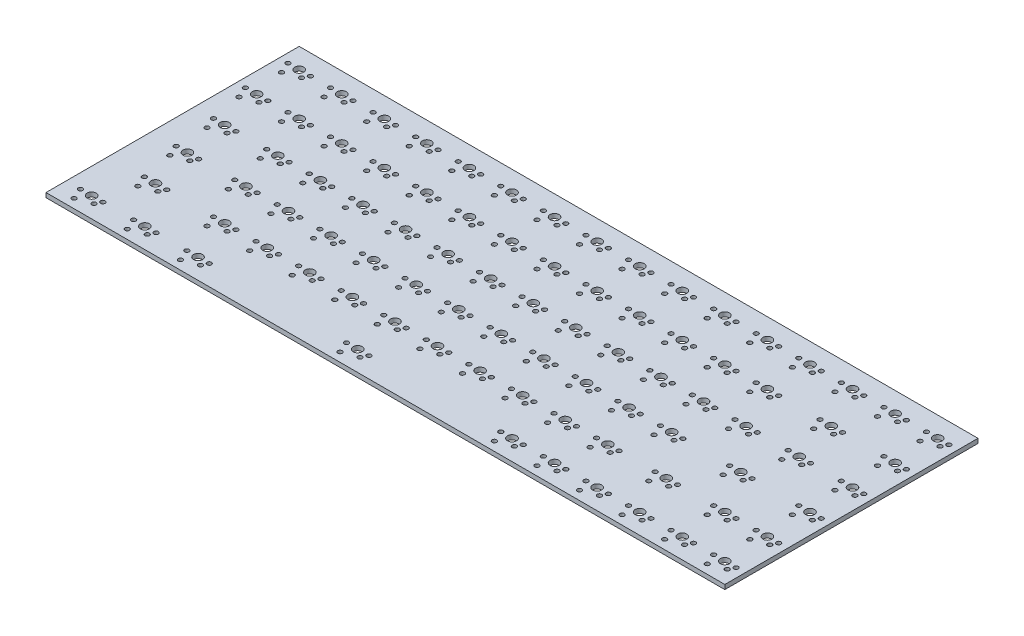
from build123d import *

# Parameters (mm, degrees)
SKETCH_1_W      = 303
SKETCH_1_H      = 113
SKETCH_1_R      = 1
SKETCH_1_R_2    = 2
EXTRUDE_1_DEPTH = 2


with BuildPart() as part:
    # Эскиз1 → Бобышка-Вытянуть1 (new body)
    with BuildSketch(Plane(origin=(0, 0, 0), x_dir=(1, 0, 0), z_dir=(0, 1, 0))):
        with Locations((142.5, -47.5)):
            Rectangle(SKETCH_1_W, SKETCH_1_H)
        with Locations(Location((3.65, -2.6, 0), (0, 0, 90))):
            Circle(SKETCH_1_R, mode=Mode.SUBTRACT)
        with Locations(Location((5, 0, 0), (0, 0, 270))):
            Circle(SKETCH_1_R, mode=Mode.SUBTRACT)
        with Locations(Location((-2.867586508, -5, 0), (0, 0, 90))):
            Circle(SKETCH_1_R, mode=Mode.SUBTRACT)
        with Locations(Location((-5, 0, 0), (0, 0, 270))):
            Circle(SKETCH_1_R, mode=Mode.SUBTRACT)
        with Locations(Location((0, 0, 0), (0, 0, 270))):
            Circle(SKETCH_1_R_2, mode=Mode.SUBTRACT)
        with Locations(Location((22.65, -2.6, 0), (0, 0, 90))):
            Circle(SKETCH_1_R, mode=Mode.SUBTRACT)
        with Locations(Location((24, 0, 0), (0, 0, 270))):
            Circle(SKETCH_1_R, mode=Mode.SUBTRACT)
        with Locations(Location((16.132413492, -5, 0), (0, 0, 90))):
            Circle(SKETCH_1_R, mode=Mode.SUBTRACT)
        with Locations(Location((14, 0, 0), (0, 0, 270))):
            Circle(SKETCH_1_R, mode=Mode.SUBTRACT)
        with Locations(Location((19, 0, 0), (0, 0, 270))):
            Circle(SKETCH_1_R_2, mode=Mode.SUBTRACT)
        with Locations(Location((41.65, -2.6, 0), (0, 0, 90))):
            Circle(SKETCH_1_R, mode=Mode.SUBTRACT)
        with Locations(Location((43, 0, 0), (0, 0, 270))):
            Circle(SKETCH_1_R, mode=Mode.SUBTRACT)
        with Locations(Location((35.132413492, -5, 0), (0, 0, 90))):
            Circle(SKETCH_1_R, mode=Mode.SUBTRACT)
        with Locations(Location((33, 0, 0), (0, 0, 270))):
            Circle(SKETCH_1_R, mode=Mode.SUBTRACT)
        with Locations(Location((38, 0, 0), (0, 0, 270))):
            Circle(SKETCH_1_R_2, mode=Mode.SUBTRACT)
        with Locations(Location((60.65, -2.6, 0), (0, 0, 90))):
            Circle(SKETCH_1_R, mode=Mode.SUBTRACT)
        with Locations(Location((62, 0, 0), (0, 0, 270))):
            Circle(SKETCH_1_R, mode=Mode.SUBTRACT)
        with Locations(Location((54.132413492, -5, 0), (0, 0, 90))):
            Circle(SKETCH_1_R, mode=Mode.SUBTRACT)
        with Locations(Location((52, 0, 0), (0, 0, 270))):
            Circle(SKETCH_1_R, mode=Mode.SUBTRACT)
        with Locations(Location((57, 0, 0), (0, 0, 270))):
            Circle(SKETCH_1_R_2, mode=Mode.SUBTRACT)
        with Locations(Location((79.65, -2.6, 0), (0, 0, 90))):
            Circle(SKETCH_1_R, mode=Mode.SUBTRACT)
        with Locations(Location((81, 0, 0), (0, 0, 270))):
            Circle(SKETCH_1_R, mode=Mode.SUBTRACT)
        with Locations(Location((73.132413492, -5, 0), (0, 0, 90))):
            Circle(SKETCH_1_R, mode=Mode.SUBTRACT)
        with Locations(Location((71, 0, 0), (0, 0, 270))):
            Circle(SKETCH_1_R, mode=Mode.SUBTRACT)
        with Locations(Location((76, 0, 0), (0, 0, 270))):
            Circle(SKETCH_1_R_2, mode=Mode.SUBTRACT)
        with Locations(Location((98.65, -2.6, 0), (0, 0, 90))):
            Circle(SKETCH_1_R, mode=Mode.SUBTRACT)
        with Locations(Location((100, 0, 0), (0, 0, 270))):
            Circle(SKETCH_1_R, mode=Mode.SUBTRACT)
        with Locations(Location((92.132413492, -5, 0), (0, 0, 90))):
            Circle(SKETCH_1_R, mode=Mode.SUBTRACT)
        with Locations(Location((90, 0, 0), (0, 0, 270))):
            Circle(SKETCH_1_R, mode=Mode.SUBTRACT)
        with Locations(Location((95, 0, 0), (0, 0, 270))):
            Circle(SKETCH_1_R_2, mode=Mode.SUBTRACT)
        with Locations(Location((117.65, -2.6, 0), (0, 0, 90))):
            Circle(SKETCH_1_R, mode=Mode.SUBTRACT)
        with Locations(Location((119, 0, 0), (0, 0, 270))):
            Circle(SKETCH_1_R, mode=Mode.SUBTRACT)
        with Locations(Location((111.132413492, -5, 0), (0, 0, 90))):
            Circle(SKETCH_1_R, mode=Mode.SUBTRACT)
        with Locations(Location((109, 0, 0), (0, 0, 270))):
            Circle(SKETCH_1_R, mode=Mode.SUBTRACT)
        with Locations(Location((114, 0, 0), (0, 0, 270))):
            Circle(SKETCH_1_R_2, mode=Mode.SUBTRACT)
        with Locations(Location((136.65, -2.6, 0), (0, 0, 90))):
            Circle(SKETCH_1_R, mode=Mode.SUBTRACT)
        with Locations(Location((138, 0, 0), (0, 0, 270))):
            Circle(SKETCH_1_R, mode=Mode.SUBTRACT)
        with Locations(Location((130.132413492, -5, 0), (0, 0, 90))):
            Circle(SKETCH_1_R, mode=Mode.SUBTRACT)
        with Locations(Location((128, 0, 0), (0, 0, 270))):
            Circle(SKETCH_1_R, mode=Mode.SUBTRACT)
        with Locations(Location((133, 0, 0), (0, 0, 270))):
            Circle(SKETCH_1_R_2, mode=Mode.SUBTRACT)
        with Locations(Location((155.65, -2.6, 0), (0, 0, 90))):
            Circle(SKETCH_1_R, mode=Mode.SUBTRACT)
        with Locations(Location((157, 0, 0), (0, 0, 270))):
            Circle(SKETCH_1_R, mode=Mode.SUBTRACT)
        with Locations(Location((149.132413492, -5, 0), (0, 0, 90))):
            Circle(SKETCH_1_R, mode=Mode.SUBTRACT)
        with Locations(Location((147, 0, 0), (0, 0, 270))):
            Circle(SKETCH_1_R, mode=Mode.SUBTRACT)
        with Locations(Location((152, 0, 0), (0, 0, 270))):
            Circle(SKETCH_1_R_2, mode=Mode.SUBTRACT)
        with Locations(Location((174.65, -2.6, 0), (0, 0, 90))):
            Circle(SKETCH_1_R, mode=Mode.SUBTRACT)
        with Locations(Location((176, 0, 0), (0, 0, 270))):
            Circle(SKETCH_1_R, mode=Mode.SUBTRACT)
        with Locations(Location((168.132413492, -5, 0), (0, 0, 90))):
            Circle(SKETCH_1_R, mode=Mode.SUBTRACT)
        with Locations(Location((166, 0, 0), (0, 0, 270))):
            Circle(SKETCH_1_R, mode=Mode.SUBTRACT)
        with Locations(Location((171, 0, 0), (0, 0, 270))):
            Circle(SKETCH_1_R_2, mode=Mode.SUBTRACT)
        with Locations(Location((193.65, -2.6, 0), (0, 0, 90))):
            Circle(SKETCH_1_R, mode=Mode.SUBTRACT)
        with Locations(Location((195, 0, 0), (0, 0, 270))):
            Circle(SKETCH_1_R, mode=Mode.SUBTRACT)
        with Locations(Location((187.132413492, -5, 0), (0, 0, 90))):
            Circle(SKETCH_1_R, mode=Mode.SUBTRACT)
        with Locations(Location((185, 0, 0), (0, 0, 270))):
            Circle(SKETCH_1_R, mode=Mode.SUBTRACT)
        with Locations(Location((190, 0, 0), (0, 0, 270))):
            Circle(SKETCH_1_R_2, mode=Mode.SUBTRACT)
        with Locations(Location((212.65, -2.6, 0), (0, 0, 90))):
            Circle(SKETCH_1_R, mode=Mode.SUBTRACT)
        with Locations(Location((214, 0, 0), (0, 0, 270))):
            Circle(SKETCH_1_R, mode=Mode.SUBTRACT)
        with Locations(Location((206.132413492, -5, 0), (0, 0, 90))):
            Circle(SKETCH_1_R, mode=Mode.SUBTRACT)
        with Locations(Location((204, 0, 0), (0, 0, 270))):
            Circle(SKETCH_1_R, mode=Mode.SUBTRACT)
        with Locations(Location((209, 0, 0), (0, 0, 270))):
            Circle(SKETCH_1_R_2, mode=Mode.SUBTRACT)
        with Locations(Location((212.65, -21.6, 0), (0, 0, 90))):
            Circle(SKETCH_1_R, mode=Mode.SUBTRACT)
        with Locations(Location((214, -19, 0), (0, 0, 270))):
            Circle(SKETCH_1_R, mode=Mode.SUBTRACT)
        with Locations(Location((206.132413492, -24, 0), (0, 0, 90))):
            Circle(SKETCH_1_R, mode=Mode.SUBTRACT)
        with Locations(Location((204, -19, 0), (0, 0, 270))):
            Circle(SKETCH_1_R, mode=Mode.SUBTRACT)
        with Locations(Location((209, -19, 0), (0, 0, 270))):
            Circle(SKETCH_1_R_2, mode=Mode.SUBTRACT)
        with Locations(Location((193.65, -21.6, 0), (0, 0, 90))):
            Circle(SKETCH_1_R, mode=Mode.SUBTRACT)
        with Locations(Location((195, -19, 0), (0, 0, 270))):
            Circle(SKETCH_1_R, mode=Mode.SUBTRACT)
        with Locations(Location((187.132413492, -24, 0), (0, 0, 90))):
            Circle(SKETCH_1_R, mode=Mode.SUBTRACT)
        with Locations(Location((185, -19, 0), (0, 0, 270))):
            Circle(SKETCH_1_R, mode=Mode.SUBTRACT)
        with Locations(Location((190, -19, 0), (0, 0, 270))):
            Circle(SKETCH_1_R_2, mode=Mode.SUBTRACT)
        with Locations(Location((174.65, -21.6, 0), (0, 0, 90))):
            Circle(SKETCH_1_R, mode=Mode.SUBTRACT)
        with Locations(Location((176, -19, 0), (0, 0, 270))):
            Circle(SKETCH_1_R, mode=Mode.SUBTRACT)
        with Locations(Location((168.132413492, -24, 0), (0, 0, 90))):
            Circle(SKETCH_1_R, mode=Mode.SUBTRACT)
        with Locations(Location((166, -19, 0), (0, 0, 270))):
            Circle(SKETCH_1_R, mode=Mode.SUBTRACT)
        with Locations(Location((171, -19, 0), (0, 0, 270))):
            Circle(SKETCH_1_R_2, mode=Mode.SUBTRACT)
        with Locations(Location((155.65, -21.6, 0), (0, 0, 90))):
            Circle(SKETCH_1_R, mode=Mode.SUBTRACT)
        with Locations(Location((157, -19, 0), (0, 0, 270))):
            Circle(SKETCH_1_R, mode=Mode.SUBTRACT)
        with Locations(Location((149.132413492, -24, 0), (0, 0, 90))):
            Circle(SKETCH_1_R, mode=Mode.SUBTRACT)
        with Locations(Location((147, -19, 0), (0, 0, 270))):
            Circle(SKETCH_1_R, mode=Mode.SUBTRACT)
        with Locations(Location((152, -19, 0), (0, 0, 270))):
            Circle(SKETCH_1_R_2, mode=Mode.SUBTRACT)
        with Locations(Location((136.65, -21.6, 0), (0, 0, 90))):
            Circle(SKETCH_1_R, mode=Mode.SUBTRACT)
        with Locations(Location((138, -19, 0), (0, 0, 270))):
            Circle(SKETCH_1_R, mode=Mode.SUBTRACT)
        with Locations(Location((130.132413492, -24, 0), (0, 0, 90))):
            Circle(SKETCH_1_R, mode=Mode.SUBTRACT)
        with Locations(Location((128, -19, 0), (0, 0, 270))):
            Circle(SKETCH_1_R, mode=Mode.SUBTRACT)
        with Locations(Location((133, -19, 0), (0, 0, 270))):
            Circle(SKETCH_1_R_2, mode=Mode.SUBTRACT)
        with Locations(Location((117.65, -21.6, 0), (0, 0, 90))):
            Circle(SKETCH_1_R, mode=Mode.SUBTRACT)
        with Locations(Location((119, -19, 0), (0, 0, 270))):
            Circle(SKETCH_1_R, mode=Mode.SUBTRACT)
        with Locations(Location((111.132413492, -24, 0), (0, 0, 90))):
            Circle(SKETCH_1_R, mode=Mode.SUBTRACT)
        with Locations(Location((109, -19, 0), (0, 0, 270))):
            Circle(SKETCH_1_R, mode=Mode.SUBTRACT)
        with Locations(Location((114, -19, 0), (0, 0, 270))):
            Circle(SKETCH_1_R_2, mode=Mode.SUBTRACT)
        with Locations(Location((98.65, -21.6, 0), (0, 0, 90))):
            Circle(SKETCH_1_R, mode=Mode.SUBTRACT)
        with Locations(Location((100, -19, 0), (0, 0, 270))):
            Circle(SKETCH_1_R, mode=Mode.SUBTRACT)
        with Locations(Location((92.132413492, -24, 0), (0, 0, 90))):
            Circle(SKETCH_1_R, mode=Mode.SUBTRACT)
        with Locations(Location((90, -19, 0), (0, 0, 270))):
            Circle(SKETCH_1_R, mode=Mode.SUBTRACT)
        with Locations(Location((95, -19, 0), (0, 0, 270))):
            Circle(SKETCH_1_R_2, mode=Mode.SUBTRACT)
        with Locations(Location((79.65, -21.6, 0), (0, 0, 90))):
            Circle(SKETCH_1_R, mode=Mode.SUBTRACT)
        with Locations(Location((81, -19, 0), (0, 0, 270))):
            Circle(SKETCH_1_R, mode=Mode.SUBTRACT)
        with Locations(Location((73.132413492, -24, 0), (0, 0, 90))):
            Circle(SKETCH_1_R, mode=Mode.SUBTRACT)
        with Locations(Location((71, -19, 0), (0, 0, 270))):
            Circle(SKETCH_1_R, mode=Mode.SUBTRACT)
        with Locations(Location((76, -19, 0), (0, 0, 270))):
            Circle(SKETCH_1_R_2, mode=Mode.SUBTRACT)
        with Locations(Location((60.65, -21.6, 0), (0, 0, 90))):
            Circle(SKETCH_1_R, mode=Mode.SUBTRACT)
        with Locations(Location((62, -19, 0), (0, 0, 270))):
            Circle(SKETCH_1_R, mode=Mode.SUBTRACT)
        with Locations(Location((54.132413492, -24, 0), (0, 0, 90))):
            Circle(SKETCH_1_R, mode=Mode.SUBTRACT)
        with Locations(Location((52, -19, 0), (0, 0, 270))):
            Circle(SKETCH_1_R, mode=Mode.SUBTRACT)
        with Locations(Location((57, -19, 0), (0, 0, 270))):
            Circle(SKETCH_1_R_2, mode=Mode.SUBTRACT)
        with Locations(Location((41.65, -21.6, 0), (0, 0, 90))):
            Circle(SKETCH_1_R, mode=Mode.SUBTRACT)
        with Locations(Location((43, -19, 0), (0, 0, 270))):
            Circle(SKETCH_1_R, mode=Mode.SUBTRACT)
        with Locations(Location((35.132413492, -24, 0), (0, 0, 90))):
            Circle(SKETCH_1_R, mode=Mode.SUBTRACT)
        with Locations(Location((33, -19, 0), (0, 0, 270))):
            Circle(SKETCH_1_R, mode=Mode.SUBTRACT)
        with Locations(Location((38, -19, 0), (0, 0, 270))):
            Circle(SKETCH_1_R_2, mode=Mode.SUBTRACT)
        with Locations(Location((22.65, -21.6, 0), (0, 0, 90))):
            Circle(SKETCH_1_R, mode=Mode.SUBTRACT)
        with Locations(Location((24, -19, 0), (0, 0, 270))):
            Circle(SKETCH_1_R, mode=Mode.SUBTRACT)
        with Locations(Location((16.132413492, -24, 0), (0, 0, 90))):
            Circle(SKETCH_1_R, mode=Mode.SUBTRACT)
        with Locations(Location((14, -19, 0), (0, 0, 270))):
            Circle(SKETCH_1_R, mode=Mode.SUBTRACT)
        with Locations(Location((19, -19, 0), (0, 0, 270))):
            Circle(SKETCH_1_R_2, mode=Mode.SUBTRACT)
        with Locations(Location((3.65, -21.6, 0), (0, 0, 90))):
            Circle(SKETCH_1_R, mode=Mode.SUBTRACT)
        with Locations(Location((5, -19, 0), (0, 0, 270))):
            Circle(SKETCH_1_R, mode=Mode.SUBTRACT)
        with Locations(Location((-2.867586508, -24, 0), (0, 0, 90))):
            Circle(SKETCH_1_R, mode=Mode.SUBTRACT)
        with Locations(Location((-5, -19, 0), (0, 0, 270))):
            Circle(SKETCH_1_R, mode=Mode.SUBTRACT)
        with Locations(Location((0, -19, 0), (0, 0, 270))):
            Circle(SKETCH_1_R_2, mode=Mode.SUBTRACT)
        with Locations(Location((8.4, -40.6, 0), (0, 0, 90))):
            Circle(SKETCH_1_R, mode=Mode.SUBTRACT)
        with Locations(Location((9.75, -38, 0), (0, 0, 270))):
            Circle(SKETCH_1_R, mode=Mode.SUBTRACT)
        with Locations(Location((1.882413492, -43, 0), (0, 0, 90))):
            Circle(SKETCH_1_R, mode=Mode.SUBTRACT)
        with Locations(Location((-0.25, -38, 0), (0, 0, 270))):
            Circle(SKETCH_1_R, mode=Mode.SUBTRACT)
        with Locations(Location((4.75, -38, 0), (0, 0, 270))):
            Circle(SKETCH_1_R_2, mode=Mode.SUBTRACT)
        with Locations(Location((32.15, -40.6, 0), (0, 0, 90))):
            Circle(SKETCH_1_R, mode=Mode.SUBTRACT)
        with Locations(Location((33.5, -38, 0), (0, 0, 270))):
            Circle(SKETCH_1_R, mode=Mode.SUBTRACT)
        with Locations(Location((25.632413492, -43, 0), (0, 0, 90))):
            Circle(SKETCH_1_R, mode=Mode.SUBTRACT)
        with Locations(Location((23.5, -38, 0), (0, 0, 270))):
            Circle(SKETCH_1_R, mode=Mode.SUBTRACT)
        with Locations(Location((28.5, -38, 0), (0, 0, 270))):
            Circle(SKETCH_1_R_2, mode=Mode.SUBTRACT)
        with Locations(Location((51.15, -40.6, 0), (0, 0, 90))):
            Circle(SKETCH_1_R, mode=Mode.SUBTRACT)
        with Locations(Location((52.5, -38, 0), (0, 0, 270))):
            Circle(SKETCH_1_R, mode=Mode.SUBTRACT)
        with Locations(Location((44.632413492, -43, 0), (0, 0, 90))):
            Circle(SKETCH_1_R, mode=Mode.SUBTRACT)
        with Locations(Location((42.5, -38, 0), (0, 0, 270))):
            Circle(SKETCH_1_R, mode=Mode.SUBTRACT)
        with Locations(Location((47.5, -38, 0), (0, 0, 270))):
            Circle(SKETCH_1_R_2, mode=Mode.SUBTRACT)
        with Locations(Location((70.15, -40.6, 0), (0, 0, 90))):
            Circle(SKETCH_1_R, mode=Mode.SUBTRACT)
        with Locations(Location((71.5, -38, 0), (0, 0, 270))):
            Circle(SKETCH_1_R, mode=Mode.SUBTRACT)
        with Locations(Location((63.632413492, -43, 0), (0, 0, 90))):
            Circle(SKETCH_1_R, mode=Mode.SUBTRACT)
        with Locations(Location((61.5, -38, 0), (0, 0, 270))):
            Circle(SKETCH_1_R, mode=Mode.SUBTRACT)
        with Locations(Location((66.5, -38, 0), (0, 0, 270))):
            Circle(SKETCH_1_R_2, mode=Mode.SUBTRACT)
        with Locations(Location((89.15, -40.6, 0), (0, 0, 90))):
            Circle(SKETCH_1_R, mode=Mode.SUBTRACT)
        with Locations(Location((90.5, -38, 0), (0, 0, 270))):
            Circle(SKETCH_1_R, mode=Mode.SUBTRACT)
        with Locations(Location((82.632413492, -43, 0), (0, 0, 90))):
            Circle(SKETCH_1_R, mode=Mode.SUBTRACT)
        with Locations(Location((80.5, -38, 0), (0, 0, 270))):
            Circle(SKETCH_1_R, mode=Mode.SUBTRACT)
        with Locations(Location((85.5, -38, 0), (0, 0, 270))):
            Circle(SKETCH_1_R_2, mode=Mode.SUBTRACT)
        with Locations(Location((104.5, -38, 0), (0, 0, 270))):
            Circle(SKETCH_1_R_2, mode=Mode.SUBTRACT)
        with Locations(Location((109.5, -38, 0), (0, 0, 270))):
            Circle(SKETCH_1_R, mode=Mode.SUBTRACT)
        with Locations(Location((99.5, -38, 0), (0, 0, 270))):
            Circle(SKETCH_1_R, mode=Mode.SUBTRACT)
        with Locations(Location((101.632413492, -43, 0), (0, 0, 90))):
            Circle(SKETCH_1_R, mode=Mode.SUBTRACT)
        with Locations(Location((108.15, -40.6, 0), (0, 0, 90))):
            Circle(SKETCH_1_R, mode=Mode.SUBTRACT)
        with Locations(Location((123.5, -38, 0), (0, 0, 270))):
            Circle(SKETCH_1_R_2, mode=Mode.SUBTRACT)
        with Locations(Location((128.5, -38, 0), (0, 0, 270))):
            Circle(SKETCH_1_R, mode=Mode.SUBTRACT)
        with Locations(Location((118.5, -38, 0), (0, 0, 270))):
            Circle(SKETCH_1_R, mode=Mode.SUBTRACT)
        with Locations(Location((120.632413492, -43, 0), (0, 0, 90))):
            Circle(SKETCH_1_R, mode=Mode.SUBTRACT)
        with Locations(Location((127.15, -40.6, 0), (0, 0, 90))):
            Circle(SKETCH_1_R, mode=Mode.SUBTRACT)
        with Locations(Location((142.5, -38, 0), (0, 0, 270))):
            Circle(SKETCH_1_R_2, mode=Mode.SUBTRACT)
        with Locations(Location((147.5, -38, 0), (0, 0, 270))):
            Circle(SKETCH_1_R, mode=Mode.SUBTRACT)
        with Locations(Location((137.5, -38, 0), (0, 0, 270))):
            Circle(SKETCH_1_R, mode=Mode.SUBTRACT)
        with Locations(Location((139.632413492, -43, 0), (0, 0, 90))):
            Circle(SKETCH_1_R, mode=Mode.SUBTRACT)
        with Locations(Location((146.15, -40.6, 0), (0, 0, 90))):
            Circle(SKETCH_1_R, mode=Mode.SUBTRACT)
        with Locations(Location((161.5, -38, 0), (0, 0, 270))):
            Circle(SKETCH_1_R_2, mode=Mode.SUBTRACT)
        with Locations(Location((166.5, -38, 0), (0, 0, 270))):
            Circle(SKETCH_1_R, mode=Mode.SUBTRACT)
        with Locations(Location((156.5, -38, 0), (0, 0, 270))):
            Circle(SKETCH_1_R, mode=Mode.SUBTRACT)
        with Locations(Location((158.632413492, -43, 0), (0, 0, 90))):
            Circle(SKETCH_1_R, mode=Mode.SUBTRACT)
        with Locations(Location((165.15, -40.6, 0), (0, 0, 90))):
            Circle(SKETCH_1_R, mode=Mode.SUBTRACT)
        with Locations(Location((180.5, -38, 0), (0, 0, 270))):
            Circle(SKETCH_1_R_2, mode=Mode.SUBTRACT)
        with Locations(Location((185.5, -38, 0), (0, 0, 270))):
            Circle(SKETCH_1_R, mode=Mode.SUBTRACT)
        with Locations(Location((175.5, -38, 0), (0, 0, 270))):
            Circle(SKETCH_1_R, mode=Mode.SUBTRACT)
        with Locations(Location((177.632413492, -43, 0), (0, 0, 90))):
            Circle(SKETCH_1_R, mode=Mode.SUBTRACT)
        with Locations(Location((184.15, -40.6, 0), (0, 0, 90))):
            Circle(SKETCH_1_R, mode=Mode.SUBTRACT)
        with Locations(Location((199.5, -38, 0), (0, 0, 270))):
            Circle(SKETCH_1_R_2, mode=Mode.SUBTRACT)
        with Locations(Location((204.5, -38, 0), (0, 0, 270))):
            Circle(SKETCH_1_R, mode=Mode.SUBTRACT)
        with Locations(Location((194.5, -38, 0), (0, 0, 270))):
            Circle(SKETCH_1_R, mode=Mode.SUBTRACT)
        with Locations(Location((196.632413492, -43, 0), (0, 0, 90))):
            Circle(SKETCH_1_R, mode=Mode.SUBTRACT)
        with Locations(Location((203.15, -40.6, 0), (0, 0, 90))):
            Circle(SKETCH_1_R, mode=Mode.SUBTRACT)
        with Locations(Location((204.25, -57, 0), (0, 0, 270))):
            Circle(SKETCH_1_R_2, mode=Mode.SUBTRACT)
        with Locations(Location((209.25, -57, 0), (0, 0, 270))):
            Circle(SKETCH_1_R, mode=Mode.SUBTRACT)
        with Locations(Location((199.25, -57, 0), (0, 0, 270))):
            Circle(SKETCH_1_R, mode=Mode.SUBTRACT)
        with Locations(Location((201.382413492, -62, 0), (0, 0, 90))):
            Circle(SKETCH_1_R, mode=Mode.SUBTRACT)
        with Locations(Location((207.9, -59.6, 0), (0, 0, 90))):
            Circle(SKETCH_1_R, mode=Mode.SUBTRACT)
        with Locations(Location((185.25, -57, 0), (0, 0, 270))):
            Circle(SKETCH_1_R_2, mode=Mode.SUBTRACT)
        with Locations(Location((190.25, -57, 0), (0, 0, 270))):
            Circle(SKETCH_1_R, mode=Mode.SUBTRACT)
        with Locations(Location((180.25, -57, 0), (0, 0, 270))):
            Circle(SKETCH_1_R, mode=Mode.SUBTRACT)
        with Locations(Location((182.382413492, -62, 0), (0, 0, 90))):
            Circle(SKETCH_1_R, mode=Mode.SUBTRACT)
        with Locations(Location((188.9, -59.6, 0), (0, 0, 90))):
            Circle(SKETCH_1_R, mode=Mode.SUBTRACT)
        with Locations(Location((166.25, -57, 0), (0, 0, 270))):
            Circle(SKETCH_1_R_2, mode=Mode.SUBTRACT)
        with Locations(Location((171.25, -57, 0), (0, 0, 270))):
            Circle(SKETCH_1_R, mode=Mode.SUBTRACT)
        with Locations(Location((161.25, -57, 0), (0, 0, 270))):
            Circle(SKETCH_1_R, mode=Mode.SUBTRACT)
        with Locations(Location((163.382413492, -62, 0), (0, 0, 90))):
            Circle(SKETCH_1_R, mode=Mode.SUBTRACT)
        with Locations(Location((169.9, -59.6, 0), (0, 0, 90))):
            Circle(SKETCH_1_R, mode=Mode.SUBTRACT)
        with Locations(Location((147.25, -57, 0), (0, 0, 270))):
            Circle(SKETCH_1_R_2, mode=Mode.SUBTRACT)
        with Locations(Location((152.25, -57, 0), (0, 0, 270))):
            Circle(SKETCH_1_R, mode=Mode.SUBTRACT)
        with Locations(Location((142.25, -57, 0), (0, 0, 270))):
            Circle(SKETCH_1_R, mode=Mode.SUBTRACT)
        with Locations(Location((144.382413492, -62, 0), (0, 0, 90))):
            Circle(SKETCH_1_R, mode=Mode.SUBTRACT)
        with Locations(Location((150.9, -59.6, 0), (0, 0, 90))):
            Circle(SKETCH_1_R, mode=Mode.SUBTRACT)
        with Locations(Location((128.25, -57, 0), (0, 0, 270))):
            Circle(SKETCH_1_R_2, mode=Mode.SUBTRACT)
        with Locations(Location((133.25, -57, 0), (0, 0, 270))):
            Circle(SKETCH_1_R, mode=Mode.SUBTRACT)
        with Locations(Location((123.25, -57, 0), (0, 0, 270))):
            Circle(SKETCH_1_R, mode=Mode.SUBTRACT)
        with Locations(Location((125.382413492, -62, 0), (0, 0, 90))):
            Circle(SKETCH_1_R, mode=Mode.SUBTRACT)
        with Locations(Location((131.9, -59.6, 0), (0, 0, 90))):
            Circle(SKETCH_1_R, mode=Mode.SUBTRACT)
        with Locations(Location((109.25, -57, 0), (0, 0, 270))):
            Circle(SKETCH_1_R_2, mode=Mode.SUBTRACT)
        with Locations(Location((114.25, -57, 0), (0, 0, 270))):
            Circle(SKETCH_1_R, mode=Mode.SUBTRACT)
        with Locations(Location((104.25, -57, 0), (0, 0, 270))):
            Circle(SKETCH_1_R, mode=Mode.SUBTRACT)
        with Locations(Location((106.382413492, -62, 0), (0, 0, 90))):
            Circle(SKETCH_1_R, mode=Mode.SUBTRACT)
        with Locations(Location((112.9, -59.6, 0), (0, 0, 90))):
            Circle(SKETCH_1_R, mode=Mode.SUBTRACT)
        with Locations(Location((90.25, -57, 0), (0, 0, 270))):
            Circle(SKETCH_1_R_2, mode=Mode.SUBTRACT)
        with Locations(Location((95.25, -57, 0), (0, 0, 270))):
            Circle(SKETCH_1_R, mode=Mode.SUBTRACT)
        with Locations(Location((85.25, -57, 0), (0, 0, 270))):
            Circle(SKETCH_1_R, mode=Mode.SUBTRACT)
        with Locations(Location((87.382413492, -62, 0), (0, 0, 90))):
            Circle(SKETCH_1_R, mode=Mode.SUBTRACT)
        with Locations(Location((93.9, -59.6, 0), (0, 0, 90))):
            Circle(SKETCH_1_R, mode=Mode.SUBTRACT)
        with Locations(Location((71.25, -57, 0), (0, 0, 270))):
            Circle(SKETCH_1_R_2, mode=Mode.SUBTRACT)
        with Locations(Location((76.25, -57, 0), (0, 0, 270))):
            Circle(SKETCH_1_R, mode=Mode.SUBTRACT)
        with Locations(Location((66.25, -57, 0), (0, 0, 270))):
            Circle(SKETCH_1_R, mode=Mode.SUBTRACT)
        with Locations(Location((68.382413492, -62, 0), (0, 0, 90))):
            Circle(SKETCH_1_R, mode=Mode.SUBTRACT)
        with Locations(Location((74.9, -59.6, 0), (0, 0, 90))):
            Circle(SKETCH_1_R, mode=Mode.SUBTRACT)
        with Locations(Location((52.25, -57, 0), (0, 0, 270))):
            Circle(SKETCH_1_R_2, mode=Mode.SUBTRACT)
        with Locations(Location((57.25, -57, 0), (0, 0, 270))):
            Circle(SKETCH_1_R, mode=Mode.SUBTRACT)
        with Locations(Location((47.25, -57, 0), (0, 0, 270))):
            Circle(SKETCH_1_R, mode=Mode.SUBTRACT)
        with Locations(Location((49.382413492, -62, 0), (0, 0, 90))):
            Circle(SKETCH_1_R, mode=Mode.SUBTRACT)
        with Locations(Location((55.9, -59.6, 0), (0, 0, 90))):
            Circle(SKETCH_1_R, mode=Mode.SUBTRACT)
        with Locations(Location((33.25, -57, 0), (0, 0, 270))):
            Circle(SKETCH_1_R_2, mode=Mode.SUBTRACT)
        with Locations(Location((38.25, -57, 0), (0, 0, 270))):
            Circle(SKETCH_1_R, mode=Mode.SUBTRACT)
        with Locations(Location((28.25, -57, 0), (0, 0, 270))):
            Circle(SKETCH_1_R, mode=Mode.SUBTRACT)
        with Locations(Location((30.382413492, -62, 0), (0, 0, 90))):
            Circle(SKETCH_1_R, mode=Mode.SUBTRACT)
        with Locations(Location((36.9, -59.6, 0), (0, 0, 90))):
            Circle(SKETCH_1_R, mode=Mode.SUBTRACT)
        with Locations(Location((7.125, -57, 0), (0, 0, 270))):
            Circle(SKETCH_1_R_2, mode=Mode.SUBTRACT)
        with Locations(Location((12.125, -57, 0), (0, 0, 270))):
            Circle(SKETCH_1_R, mode=Mode.SUBTRACT)
        with Locations(Location((2.125, -57, 0), (0, 0, 270))):
            Circle(SKETCH_1_R, mode=Mode.SUBTRACT)
        with Locations(Location((4.257413492, -62, 0), (0, 0, 90))):
            Circle(SKETCH_1_R, mode=Mode.SUBTRACT)
        with Locations(Location((10.775, -59.6, 0), (0, 0, 90))):
            Circle(SKETCH_1_R, mode=Mode.SUBTRACT)
        with Locations(Location((11.875, -76, 0), (0, 0, 270))):
            Circle(SKETCH_1_R_2, mode=Mode.SUBTRACT)
        with Locations(Location((16.875, -76, 0), (0, 0, 270))):
            Circle(SKETCH_1_R, mode=Mode.SUBTRACT)
        with Locations(Location((6.875, -76, 0), (0, 0, 270))):
            Circle(SKETCH_1_R, mode=Mode.SUBTRACT)
        with Locations(Location((9.007413492, -81, 0), (0, 0, 90))):
            Circle(SKETCH_1_R, mode=Mode.SUBTRACT)
        with Locations(Location((15.525, -78.6, 0), (0, 0, 90))):
            Circle(SKETCH_1_R, mode=Mode.SUBTRACT)
        with Locations(Location((42.75, -76, 0), (0, 0, 270))):
            Circle(SKETCH_1_R_2, mode=Mode.SUBTRACT)
        with Locations(Location((47.75, -76, 0), (0, 0, 270))):
            Circle(SKETCH_1_R, mode=Mode.SUBTRACT)
        with Locations(Location((37.75, -76, 0), (0, 0, 270))):
            Circle(SKETCH_1_R, mode=Mode.SUBTRACT)
        with Locations(Location((39.882413492, -81, 0), (0, 0, 90))):
            Circle(SKETCH_1_R, mode=Mode.SUBTRACT)
        with Locations(Location((46.4, -78.6, 0), (0, 0, 90))):
            Circle(SKETCH_1_R, mode=Mode.SUBTRACT)
        with Locations(Location((61.75, -76, 0), (0, 0, 270))):
            Circle(SKETCH_1_R_2, mode=Mode.SUBTRACT)
        with Locations(Location((66.75, -76, 0), (0, 0, 270))):
            Circle(SKETCH_1_R, mode=Mode.SUBTRACT)
        with Locations(Location((56.75, -76, 0), (0, 0, 270))):
            Circle(SKETCH_1_R, mode=Mode.SUBTRACT)
        with Locations(Location((58.882413492, -81, 0), (0, 0, 90))):
            Circle(SKETCH_1_R, mode=Mode.SUBTRACT)
        with Locations(Location((65.4, -78.6, 0), (0, 0, 90))):
            Circle(SKETCH_1_R, mode=Mode.SUBTRACT)
        with Locations(Location((80.75, -76, 0), (0, 0, 270))):
            Circle(SKETCH_1_R_2, mode=Mode.SUBTRACT)
        with Locations(Location((85.75, -76, 0), (0, 0, 270))):
            Circle(SKETCH_1_R, mode=Mode.SUBTRACT)
        with Locations(Location((75.75, -76, 0), (0, 0, 270))):
            Circle(SKETCH_1_R, mode=Mode.SUBTRACT)
        with Locations(Location((77.882413492, -81, 0), (0, 0, 90))):
            Circle(SKETCH_1_R, mode=Mode.SUBTRACT)
        with Locations(Location((84.4, -78.6, 0), (0, 0, 90))):
            Circle(SKETCH_1_R, mode=Mode.SUBTRACT)
        with Locations(Location((99.75, -76, 0), (0, 0, 270))):
            Circle(SKETCH_1_R_2, mode=Mode.SUBTRACT)
        with Locations(Location((104.75, -76, 0), (0, 0, 270))):
            Circle(SKETCH_1_R, mode=Mode.SUBTRACT)
        with Locations(Location((94.75, -76, 0), (0, 0, 270))):
            Circle(SKETCH_1_R, mode=Mode.SUBTRACT)
        with Locations(Location((96.882413492, -81, 0), (0, 0, 90))):
            Circle(SKETCH_1_R, mode=Mode.SUBTRACT)
        with Locations(Location((103.4, -78.6, 0), (0, 0, 90))):
            Circle(SKETCH_1_R, mode=Mode.SUBTRACT)
        with Locations(Location((118.75, -76, 0), (0, 0, 270))):
            Circle(SKETCH_1_R_2, mode=Mode.SUBTRACT)
        with Locations(Location((123.75, -76, 0), (0, 0, 270))):
            Circle(SKETCH_1_R, mode=Mode.SUBTRACT)
        with Locations(Location((113.75, -76, 0), (0, 0, 270))):
            Circle(SKETCH_1_R, mode=Mode.SUBTRACT)
        with Locations(Location((115.882413492, -81, 0), (0, 0, 90))):
            Circle(SKETCH_1_R, mode=Mode.SUBTRACT)
        with Locations(Location((122.4, -78.6, 0), (0, 0, 90))):
            Circle(SKETCH_1_R, mode=Mode.SUBTRACT)
        with Locations(Location((137.75, -76, 0), (0, 0, 270))):
            Circle(SKETCH_1_R_2, mode=Mode.SUBTRACT)
        with Locations(Location((142.75, -76, 0), (0, 0, 270))):
            Circle(SKETCH_1_R, mode=Mode.SUBTRACT)
        with Locations(Location((132.75, -76, 0), (0, 0, 270))):
            Circle(SKETCH_1_R, mode=Mode.SUBTRACT)
        with Locations(Location((134.882413492, -81, 0), (0, 0, 90))):
            Circle(SKETCH_1_R, mode=Mode.SUBTRACT)
        with Locations(Location((141.4, -78.6, 0), (0, 0, 90))):
            Circle(SKETCH_1_R, mode=Mode.SUBTRACT)
        with Locations(Location((156.75, -76, 0), (0, 0, 270))):
            Circle(SKETCH_1_R_2, mode=Mode.SUBTRACT)
        with Locations(Location((161.75, -76, 0), (0, 0, 270))):
            Circle(SKETCH_1_R, mode=Mode.SUBTRACT)
        with Locations(Location((151.75, -76, 0), (0, 0, 270))):
            Circle(SKETCH_1_R, mode=Mode.SUBTRACT)
        with Locations(Location((153.882413492, -81, 0), (0, 0, 90))):
            Circle(SKETCH_1_R, mode=Mode.SUBTRACT)
        with Locations(Location((160.4, -78.6, 0), (0, 0, 90))):
            Circle(SKETCH_1_R, mode=Mode.SUBTRACT)
        with Locations(Location((175.75, -76, 0), (0, 0, 270))):
            Circle(SKETCH_1_R_2, mode=Mode.SUBTRACT)
        with Locations(Location((180.75, -76, 0), (0, 0, 270))):
            Circle(SKETCH_1_R, mode=Mode.SUBTRACT)
        with Locations(Location((170.75, -76, 0), (0, 0, 270))):
            Circle(SKETCH_1_R, mode=Mode.SUBTRACT)
        with Locations(Location((172.882413492, -81, 0), (0, 0, 90))):
            Circle(SKETCH_1_R, mode=Mode.SUBTRACT)
        with Locations(Location((179.4, -78.6, 0), (0, 0, 90))):
            Circle(SKETCH_1_R, mode=Mode.SUBTRACT)
        with Locations(Location((194.75, -76, 0), (0, 0, 270))):
            Circle(SKETCH_1_R_2, mode=Mode.SUBTRACT)
        with Locations(Location((199.75, -76, 0), (0, 0, 270))):
            Circle(SKETCH_1_R, mode=Mode.SUBTRACT)
        with Locations(Location((189.75, -76, 0), (0, 0, 270))):
            Circle(SKETCH_1_R, mode=Mode.SUBTRACT)
        with Locations(Location((191.882413492, -81, 0), (0, 0, 90))):
            Circle(SKETCH_1_R, mode=Mode.SUBTRACT)
        with Locations(Location((198.4, -78.6, 0), (0, 0, 90))):
            Circle(SKETCH_1_R, mode=Mode.SUBTRACT)
        with Locations(Location((213.75, -76, 0), (0, 0, 270))):
            Circle(SKETCH_1_R_2, mode=Mode.SUBTRACT)
        with Locations(Location((218.75, -76, 0), (0, 0, 270))):
            Circle(SKETCH_1_R, mode=Mode.SUBTRACT)
        with Locations(Location((208.75, -76, 0), (0, 0, 270))):
            Circle(SKETCH_1_R, mode=Mode.SUBTRACT)
        with Locations(Location((210.882413492, -81, 0), (0, 0, 90))):
            Circle(SKETCH_1_R, mode=Mode.SUBTRACT)
        with Locations(Location((217.4, -78.6, 0), (0, 0, 90))):
            Circle(SKETCH_1_R, mode=Mode.SUBTRACT)
        with Locations(Location((239.875, -76, 0), (0, 0, 270))):
            Circle(SKETCH_1_R_2, mode=Mode.SUBTRACT)
        with Locations(Location((244.875, -76, 0), (0, 0, 270))):
            Circle(SKETCH_1_R, mode=Mode.SUBTRACT)
        with Locations(Location((234.875, -76, 0), (0, 0, 270))):
            Circle(SKETCH_1_R, mode=Mode.SUBTRACT)
        with Locations(Location((237.007413492, -81, 0), (0, 0, 90))):
            Circle(SKETCH_1_R, mode=Mode.SUBTRACT)
        with Locations(Location((243.525, -78.6, 0), (0, 0, 90))):
            Circle(SKETCH_1_R, mode=Mode.SUBTRACT)
        with Locations(Location((2.375, -95, 0), (0, 0, 270))):
            Circle(SKETCH_1_R_2, mode=Mode.SUBTRACT)
        with Locations(Location((7.375, -95, 0), (0, 0, 270))):
            Circle(SKETCH_1_R, mode=Mode.SUBTRACT)
        with Locations(Location((-2.625, -95, 0), (0, 0, 270))):
            Circle(SKETCH_1_R, mode=Mode.SUBTRACT)
        with Locations(Location((-0.492586508, -100, 0), (0, 0, 90))):
            Circle(SKETCH_1_R, mode=Mode.SUBTRACT)
        with Locations(Location((6.025, -97.6, 0), (0, 0, 90))):
            Circle(SKETCH_1_R, mode=Mode.SUBTRACT)
        with Locations(Location((26.125, -95, 0), (0, 0, 270))):
            Circle(SKETCH_1_R_2, mode=Mode.SUBTRACT)
        with Locations(Location((31.125, -95, 0), (0, 0, 270))):
            Circle(SKETCH_1_R, mode=Mode.SUBTRACT)
        with Locations(Location((21.125, -95, 0), (0, 0, 270))):
            Circle(SKETCH_1_R, mode=Mode.SUBTRACT)
        with Locations(Location((23.257413492, -100, 0), (0, 0, 90))):
            Circle(SKETCH_1_R, mode=Mode.SUBTRACT)
        with Locations(Location((29.775, -97.6, 0), (0, 0, 90))):
            Circle(SKETCH_1_R, mode=Mode.SUBTRACT)
        with Locations(Location((49.875, -95, 0), (0, 0, 270))):
            Circle(SKETCH_1_R_2, mode=Mode.SUBTRACT)
        with Locations(Location((54.875, -95, 0), (0, 0, 270))):
            Circle(SKETCH_1_R, mode=Mode.SUBTRACT)
        with Locations(Location((44.875, -95, 0), (0, 0, 270))):
            Circle(SKETCH_1_R, mode=Mode.SUBTRACT)
        with Locations(Location((47.007413492, -100, 0), (0, 0, 90))):
            Circle(SKETCH_1_R, mode=Mode.SUBTRACT)
        with Locations(Location((53.525, -97.6, 0), (0, 0, 90))):
            Circle(SKETCH_1_R, mode=Mode.SUBTRACT)
        with Locations(Location((121.125, -95, 0), (0, 0, 270))):
            Circle(SKETCH_1_R_2, mode=Mode.SUBTRACT)
        with Locations(Location((126.125, -95, 0), (0, 0, 270))):
            Circle(SKETCH_1_R, mode=Mode.SUBTRACT)
        with Locations(Location((116.125, -95, 0), (0, 0, 270))):
            Circle(SKETCH_1_R, mode=Mode.SUBTRACT)
        with Locations(Location((118.257413492, -100, 0), (0, 0, 90))):
            Circle(SKETCH_1_R, mode=Mode.SUBTRACT)
        with Locations(Location((124.775, -97.6, 0), (0, 0, 90))):
            Circle(SKETCH_1_R, mode=Mode.SUBTRACT)
        with Locations(Location((190, -95, 0), (0, 0, 270))):
            Circle(SKETCH_1_R_2, mode=Mode.SUBTRACT)
        with Locations(Location((195, -95, 0), (0, 0, 270))):
            Circle(SKETCH_1_R, mode=Mode.SUBTRACT)
        with Locations(Location((185, -95, 0), (0, 0, 270))):
            Circle(SKETCH_1_R, mode=Mode.SUBTRACT)
        with Locations(Location((187.132413492, -100, 0), (0, 0, 90))):
            Circle(SKETCH_1_R, mode=Mode.SUBTRACT)
        with Locations(Location((193.65, -97.6, 0), (0, 0, 90))):
            Circle(SKETCH_1_R, mode=Mode.SUBTRACT)
        with Locations(Location((209, -95, 0), (0, 0, 270))):
            Circle(SKETCH_1_R_2, mode=Mode.SUBTRACT)
        with Locations(Location((214, -95, 0), (0, 0, 270))):
            Circle(SKETCH_1_R, mode=Mode.SUBTRACT)
        with Locations(Location((204, -95, 0), (0, 0, 270))):
            Circle(SKETCH_1_R, mode=Mode.SUBTRACT)
        with Locations(Location((206.132413492, -100, 0), (0, 0, 90))):
            Circle(SKETCH_1_R, mode=Mode.SUBTRACT)
        with Locations(Location((212.65, -97.6, 0), (0, 0, 90))):
            Circle(SKETCH_1_R, mode=Mode.SUBTRACT)
        with Locations(Location((228, -95, 0), (0, 0, 270))):
            Circle(SKETCH_1_R_2, mode=Mode.SUBTRACT)
        with Locations(Location((233, -95, 0), (0, 0, 270))):
            Circle(SKETCH_1_R, mode=Mode.SUBTRACT)
        with Locations(Location((223, -95, 0), (0, 0, 270))):
            Circle(SKETCH_1_R, mode=Mode.SUBTRACT)
        with Locations(Location((225.132413492, -100, 0), (0, 0, 90))):
            Circle(SKETCH_1_R, mode=Mode.SUBTRACT)
        with Locations(Location((231.65, -97.6, 0), (0, 0, 90))):
            Circle(SKETCH_1_R, mode=Mode.SUBTRACT)
        with Locations(Location((247, -95, 0), (0, 0, 270))):
            Circle(SKETCH_1_R_2, mode=Mode.SUBTRACT)
        with Locations(Location((252, -95, 0), (0, 0, 270))):
            Circle(SKETCH_1_R, mode=Mode.SUBTRACT)
        with Locations(Location((242, -95, 0), (0, 0, 270))):
            Circle(SKETCH_1_R, mode=Mode.SUBTRACT)
        with Locations(Location((244.132413492, -100, 0), (0, 0, 90))):
            Circle(SKETCH_1_R, mode=Mode.SUBTRACT)
        with Locations(Location((250.65, -97.6, 0), (0, 0, 90))):
            Circle(SKETCH_1_R, mode=Mode.SUBTRACT)
        with Locations(Location((266, -95, 0), (0, 0, 270))):
            Circle(SKETCH_1_R_2, mode=Mode.SUBTRACT)
        with Locations(Location((271, -95, 0), (0, 0, 270))):
            Circle(SKETCH_1_R, mode=Mode.SUBTRACT)
        with Locations(Location((261, -95, 0), (0, 0, 270))):
            Circle(SKETCH_1_R, mode=Mode.SUBTRACT)
        with Locations(Location((263.132413492, -100, 0), (0, 0, 90))):
            Circle(SKETCH_1_R, mode=Mode.SUBTRACT)
        with Locations(Location((269.65, -97.6, 0), (0, 0, 90))):
            Circle(SKETCH_1_R, mode=Mode.SUBTRACT)
        with Locations(Location((266, -76, 0), (0, 0, 270))):
            Circle(SKETCH_1_R_2, mode=Mode.SUBTRACT)
        with Locations(Location((271, -76, 0), (0, 0, 270))):
            Circle(SKETCH_1_R, mode=Mode.SUBTRACT)
        with Locations(Location((261, -76, 0), (0, 0, 270))):
            Circle(SKETCH_1_R, mode=Mode.SUBTRACT)
        with Locations(Location((263.132413492, -81, 0), (0, 0, 90))):
            Circle(SKETCH_1_R, mode=Mode.SUBTRACT)
        with Locations(Location((269.65, -78.6, 0), (0, 0, 90))):
            Circle(SKETCH_1_R, mode=Mode.SUBTRACT)
        with Locations(Location((254.125, -57, 0), (0, 0, 270))):
            Circle(SKETCH_1_R_2, mode=Mode.SUBTRACT)
        with Locations(Location((259.125, -57, 0), (0, 0, 270))):
            Circle(SKETCH_1_R, mode=Mode.SUBTRACT)
        with Locations(Location((249.125, -57, 0), (0, 0, 270))):
            Circle(SKETCH_1_R, mode=Mode.SUBTRACT)
        with Locations(Location((251.257413492, -62, 0), (0, 0, 90))):
            Circle(SKETCH_1_R, mode=Mode.SUBTRACT)
        with Locations(Location((257.775, -59.6, 0), (0, 0, 90))):
            Circle(SKETCH_1_R, mode=Mode.SUBTRACT)
        with Locations(Location((223.25, -57, 0), (0, 0, 270))):
            Circle(SKETCH_1_R_2, mode=Mode.SUBTRACT)
        with Locations(Location((228.25, -57, 0), (0, 0, 270))):
            Circle(SKETCH_1_R, mode=Mode.SUBTRACT)
        with Locations(Location((218.25, -57, 0), (0, 0, 270))):
            Circle(SKETCH_1_R, mode=Mode.SUBTRACT)
        with Locations(Location((220.382413492, -62, 0), (0, 0, 90))):
            Circle(SKETCH_1_R, mode=Mode.SUBTRACT)
        with Locations(Location((226.9, -59.6, 0), (0, 0, 90))):
            Circle(SKETCH_1_R, mode=Mode.SUBTRACT)
        with Locations(Location((218.5, -38, 0), (0, 0, 270))):
            Circle(SKETCH_1_R_2, mode=Mode.SUBTRACT)
        with Locations(Location((223.5, -38, 0), (0, 0, 270))):
            Circle(SKETCH_1_R, mode=Mode.SUBTRACT)
        with Locations(Location((213.5, -38, 0), (0, 0, 270))):
            Circle(SKETCH_1_R, mode=Mode.SUBTRACT)
        with Locations(Location((215.632413492, -43, 0), (0, 0, 90))):
            Circle(SKETCH_1_R, mode=Mode.SUBTRACT)
        with Locations(Location((222.15, -40.6, 0), (0, 0, 90))):
            Circle(SKETCH_1_R, mode=Mode.SUBTRACT)
        with Locations(Location((237.5, -38, 0), (0, 0, 270))):
            Circle(SKETCH_1_R_2, mode=Mode.SUBTRACT)
        with Locations(Location((242.5, -38, 0), (0, 0, 270))):
            Circle(SKETCH_1_R, mode=Mode.SUBTRACT)
        with Locations(Location((232.5, -38, 0), (0, 0, 270))):
            Circle(SKETCH_1_R, mode=Mode.SUBTRACT)
        with Locations(Location((234.632413492, -43, 0), (0, 0, 90))):
            Circle(SKETCH_1_R, mode=Mode.SUBTRACT)
        with Locations(Location((241.15, -40.6, 0), (0, 0, 90))):
            Circle(SKETCH_1_R, mode=Mode.SUBTRACT)
        with Locations(Location((261.25, -38, 0), (0, 0, 270))):
            Circle(SKETCH_1_R_2, mode=Mode.SUBTRACT)
        with Locations(Location((266.25, -38, 0), (0, 0, 270))):
            Circle(SKETCH_1_R, mode=Mode.SUBTRACT)
        with Locations(Location((256.25, -38, 0), (0, 0, 270))):
            Circle(SKETCH_1_R, mode=Mode.SUBTRACT)
        with Locations(Location((258.382413492, -43, 0), (0, 0, 90))):
            Circle(SKETCH_1_R, mode=Mode.SUBTRACT)
        with Locations(Location((264.9, -40.6, 0), (0, 0, 90))):
            Circle(SKETCH_1_R, mode=Mode.SUBTRACT)
        with Locations(Location((256.5, -19, 0), (0, 0, 270))):
            Circle(SKETCH_1_R_2, mode=Mode.SUBTRACT)
        with Locations(Location((261.5, -19, 0), (0, 0, 270))):
            Circle(SKETCH_1_R, mode=Mode.SUBTRACT)
        with Locations(Location((251.5, -19, 0), (0, 0, 270))):
            Circle(SKETCH_1_R, mode=Mode.SUBTRACT)
        with Locations(Location((253.632413492, -24, 0), (0, 0, 90))):
            Circle(SKETCH_1_R, mode=Mode.SUBTRACT)
        with Locations(Location((260.15, -21.6, 0), (0, 0, 90))):
            Circle(SKETCH_1_R, mode=Mode.SUBTRACT)
        with Locations(Location((228, -19, 0), (0, 0, 270))):
            Circle(SKETCH_1_R_2, mode=Mode.SUBTRACT)
        with Locations(Location((233, -19, 0), (0, 0, 270))):
            Circle(SKETCH_1_R, mode=Mode.SUBTRACT)
        with Locations(Location((223, -19, 0), (0, 0, 270))):
            Circle(SKETCH_1_R, mode=Mode.SUBTRACT)
        with Locations(Location((225.132413492, -24, 0), (0, 0, 90))):
            Circle(SKETCH_1_R, mode=Mode.SUBTRACT)
        with Locations(Location((231.65, -21.6, 0), (0, 0, 90))):
            Circle(SKETCH_1_R, mode=Mode.SUBTRACT)
        with Locations(Location((228, 0, 0), (0, 0, 270))):
            Circle(SKETCH_1_R_2, mode=Mode.SUBTRACT)
        with Locations(Location((233, 0, 0), (0, 0, 270))):
            Circle(SKETCH_1_R, mode=Mode.SUBTRACT)
        with Locations(Location((223, 0, 0), (0, 0, 270))):
            Circle(SKETCH_1_R, mode=Mode.SUBTRACT)
        with Locations(Location((225.132413492, -5, 0), (0, 0, 90))):
            Circle(SKETCH_1_R, mode=Mode.SUBTRACT)
        with Locations(Location((231.65, -2.6, 0), (0, 0, 90))):
            Circle(SKETCH_1_R, mode=Mode.SUBTRACT)
        with Locations(Location((247, 0, 0), (0, 0, 270))):
            Circle(SKETCH_1_R_2, mode=Mode.SUBTRACT)
        with Locations(Location((252, 0, 0), (0, 0, 270))):
            Circle(SKETCH_1_R, mode=Mode.SUBTRACT)
        with Locations(Location((242, 0, 0), (0, 0, 270))):
            Circle(SKETCH_1_R, mode=Mode.SUBTRACT)
        with Locations(Location((244.132413492, -5, 0), (0, 0, 90))):
            Circle(SKETCH_1_R, mode=Mode.SUBTRACT)
        with Locations(Location((250.65, -2.6, 0), (0, 0, 90))):
            Circle(SKETCH_1_R, mode=Mode.SUBTRACT)
        with Locations(Location((266, 0, 0), (0, 0, 270))):
            Circle(SKETCH_1_R_2, mode=Mode.SUBTRACT)
        with Locations(Location((271, 0, 0), (0, 0, 270))):
            Circle(SKETCH_1_R, mode=Mode.SUBTRACT)
        with Locations(Location((261, 0, 0), (0, 0, 270))):
            Circle(SKETCH_1_R, mode=Mode.SUBTRACT)
        with Locations(Location((263.132413492, -5, 0), (0, 0, 90))):
            Circle(SKETCH_1_R, mode=Mode.SUBTRACT)
        with Locations(Location((269.65, -2.6, 0), (0, 0, 90))):
            Circle(SKETCH_1_R, mode=Mode.SUBTRACT)
        with Locations(Location((285, -95, 0), (0, 0, 270))):
            Circle(SKETCH_1_R_2, mode=Mode.SUBTRACT)
        with Locations(Location((290, -95, 0), (0, 0, 270))):
            Circle(SKETCH_1_R, mode=Mode.SUBTRACT)
        with Locations(Location((280, -95, 0), (0, 0, 270))):
            Circle(SKETCH_1_R, mode=Mode.SUBTRACT)
        with Locations(Location((282.132413492, -100, 0), (0, 0, 90))):
            Circle(SKETCH_1_R, mode=Mode.SUBTRACT)
        with Locations(Location((288.65, -97.6, 0), (0, 0, 90))):
            Circle(SKETCH_1_R, mode=Mode.SUBTRACT)
        with Locations(Location((285, -76, 0), (0, 0, 270))):
            Circle(SKETCH_1_R_2, mode=Mode.SUBTRACT)
        with Locations(Location((290, -76, 0), (0, 0, 270))):
            Circle(SKETCH_1_R, mode=Mode.SUBTRACT)
        with Locations(Location((280, -76, 0), (0, 0, 270))):
            Circle(SKETCH_1_R, mode=Mode.SUBTRACT)
        with Locations(Location((282.132413492, -81, 0), (0, 0, 90))):
            Circle(SKETCH_1_R, mode=Mode.SUBTRACT)
        with Locations(Location((288.65, -78.6, 0), (0, 0, 90))):
            Circle(SKETCH_1_R, mode=Mode.SUBTRACT)
        with Locations(Location((285, -57, 0), (0, 0, 270))):
            Circle(SKETCH_1_R_2, mode=Mode.SUBTRACT)
        with Locations(Location((290, -57, 0), (0, 0, 270))):
            Circle(SKETCH_1_R, mode=Mode.SUBTRACT)
        with Locations(Location((280, -57, 0), (0, 0, 270))):
            Circle(SKETCH_1_R, mode=Mode.SUBTRACT)
        with Locations(Location((282.132413492, -62, 0), (0, 0, 90))):
            Circle(SKETCH_1_R, mode=Mode.SUBTRACT)
        with Locations(Location((288.65, -59.6, 0), (0, 0, 90))):
            Circle(SKETCH_1_R, mode=Mode.SUBTRACT)
        with Locations(Location((285, -38, 0), (0, 0, 270))):
            Circle(SKETCH_1_R_2, mode=Mode.SUBTRACT)
        with Locations(Location((290, -38, 0), (0, 0, 270))):
            Circle(SKETCH_1_R, mode=Mode.SUBTRACT)
        with Locations(Location((280, -38, 0), (0, 0, 270))):
            Circle(SKETCH_1_R, mode=Mode.SUBTRACT)
        with Locations(Location((282.132413492, -43, 0), (0, 0, 90))):
            Circle(SKETCH_1_R, mode=Mode.SUBTRACT)
        with Locations(Location((288.65, -40.6, 0), (0, 0, 90))):
            Circle(SKETCH_1_R, mode=Mode.SUBTRACT)
        with Locations(Location((285, -19, 0), (0, 0, 270))):
            Circle(SKETCH_1_R_2, mode=Mode.SUBTRACT)
        with Locations(Location((290, -19, 0), (0, 0, 270))):
            Circle(SKETCH_1_R, mode=Mode.SUBTRACT)
        with Locations(Location((280, -19, 0), (0, 0, 270))):
            Circle(SKETCH_1_R, mode=Mode.SUBTRACT)
        with Locations(Location((282.132413492, -24, 0), (0, 0, 90))):
            Circle(SKETCH_1_R, mode=Mode.SUBTRACT)
        with Locations(Location((288.65, -21.6, 0), (0, 0, 90))):
            Circle(SKETCH_1_R, mode=Mode.SUBTRACT)
        with Locations(Location((285, 0, 0), (0, 0, 270))):
            Circle(SKETCH_1_R_2, mode=Mode.SUBTRACT)
        with Locations(Location((290, 0, 0), (0, 0, 270))):
            Circle(SKETCH_1_R, mode=Mode.SUBTRACT)
        with Locations(Location((280, 0, 0), (0, 0, 270))):
            Circle(SKETCH_1_R, mode=Mode.SUBTRACT)
        with Locations(Location((282.132413492, -5, 0), (0, 0, 90))):
            Circle(SKETCH_1_R, mode=Mode.SUBTRACT)
        with Locations(Location((288.65, -2.6, 0), (0, 0, 90))):
            Circle(SKETCH_1_R, mode=Mode.SUBTRACT)
    extrude(amount=EXTRUDE_1_DEPTH)


solid = part.part
